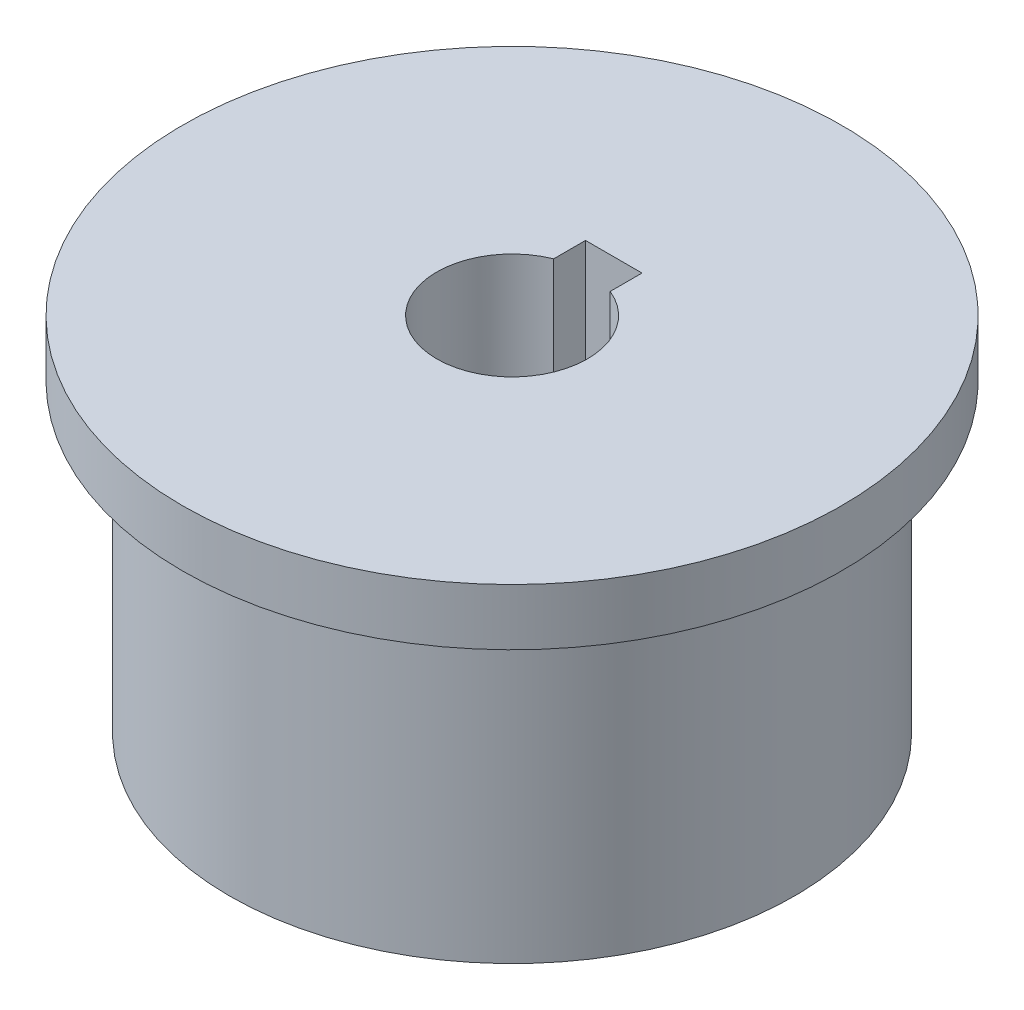
from build123d import *

# Parameters (mm, degrees)
ENL_V_MAT_EXTRU_1_DEPTH = 16.5


with BuildPart() as part:
    # Sketch1 → Revolve1 (revolve)
    with BuildSketch(Plane.XY, mode=Mode.PRIVATE) as revolve1_sk:
        Polygon((4, 19.2), (17.5, 19.2), (17.5, 16.2), (15, 16.2), (15, 0), (9, 0), (5, -4), (4, -4), align=None)
    revolve(revolve1_sk.sketch.rotate(Axis((0, 12.709342281, 0), (0, -1, 0)), 90), axis=Axis((0, 12.709342281, 0), (0, -1, 0)))

    # Esquisse1 → Enlèv. mat.-Extru.1 (cut)
    with BuildSketch(Plane(origin=(0, 19.2, 0), x_dir=(1, 0, 0), z_dir=(0, 1, 0))):
        with BuildLine():
            Line((-1.5, 5.4), (-1.5, 3.708099244))
            ThreePointArc((-1.5, 3.708099244), (0, 4), (1.5, 3.708099244))
            Line((1.5, 3.708099244), (1.5, 5.4))
            Line((1.5, 5.4), (-1.5, 5.4))
        make_face()
    extrude(amount=-ENL_V_MAT_EXTRU_1_DEPTH, mode=Mode.SUBTRACT)


solid = part.part
